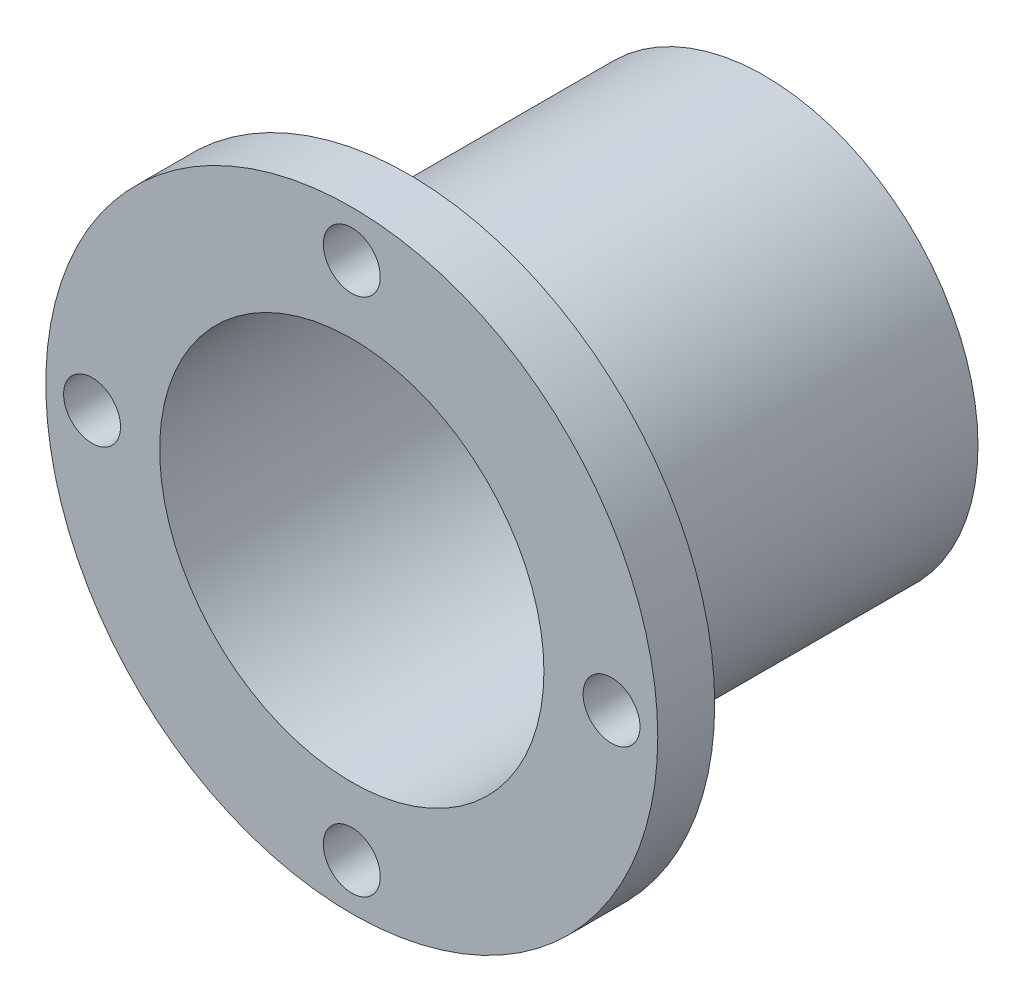
from build123d import *

# Parameters (mm, degrees)
SKETCH_1_R      = 15
SKETCH_1_R_2    = 13.5
EXTRUDE_1_DEPTH = 25
SKETCH_2_R      = 21.5
SKETCH_2_R_2    = 13.5
SKETCH_2_R_3    = 2
EXTRUDE_3_DEPTH = 4
FILLET_2_R      = 1


with BuildPart() as part:
    # 草图1 → 凸台-拉伸1 (new body)
    with BuildSketch(Plane.XY):
        Circle(SKETCH_1_R)
        Circle(SKETCH_1_R_2, mode=Mode.SUBTRACT)
    extrude(amount=EXTRUDE_1_DEPTH)

    # 草图2 → 凸台-拉伸3 (add)
    with BuildSketch(Plane.XY.offset(25)):
        Circle(SKETCH_2_R)
        Circle(SKETCH_2_R_2, mode=Mode.SUBTRACT)
        with Locations((0, 18.25)):
            Circle(SKETCH_2_R_3, mode=Mode.SUBTRACT)
        with Locations((18.25, 0)):
            Circle(SKETCH_2_R_3, mode=Mode.SUBTRACT)
        with Locations((0, -18.25)):
            Circle(SKETCH_2_R_3, mode=Mode.SUBTRACT)
        with Locations((-18.25, 0)):
            Circle(SKETCH_2_R_3, mode=Mode.SUBTRACT)
    extrude(amount=EXTRUDE_3_DEPTH)

    # 圆角2
    fillet_2_edges = [part.edges().sort_by_distance(p)[0] for p in [
        (-15, 0, 25),
    ]]
    fillet(fillet_2_edges, radius=FILLET_2_R)


solid = part.part
